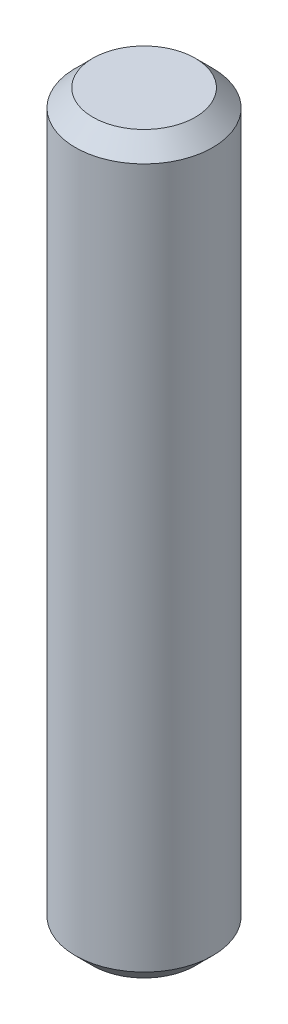
from build123d import *

# Parameters (mm, degrees)
SKETCH1_R           = 3.925
BOSS_EXTRUDE1_DEPTH = 42
CHAMFER1_SIZE       = 1


with BuildPart() as part:
    # Sketch1 → Boss-Extrude1 (new body)
    with BuildSketch(Plane(origin=(0, 0, 0), x_dir=(1, 0, 0), z_dir=(0, 1, 0))):
        with Locations(Location((0, 0, 0), (0, 0, 90))):
            Circle(SKETCH1_R)
    extrude(amount=BOSS_EXTRUDE1_DEPTH)

    # Chamfer1
    chamfer1_edges = [part.edges().sort_by_distance(p)[0] for p in [
        (0, 0, 3.925),
        (0, 42, 3.925),
    ]]
    chamfer(chamfer1_edges, length=CHAMFER1_SIZE)


solid = part.part
